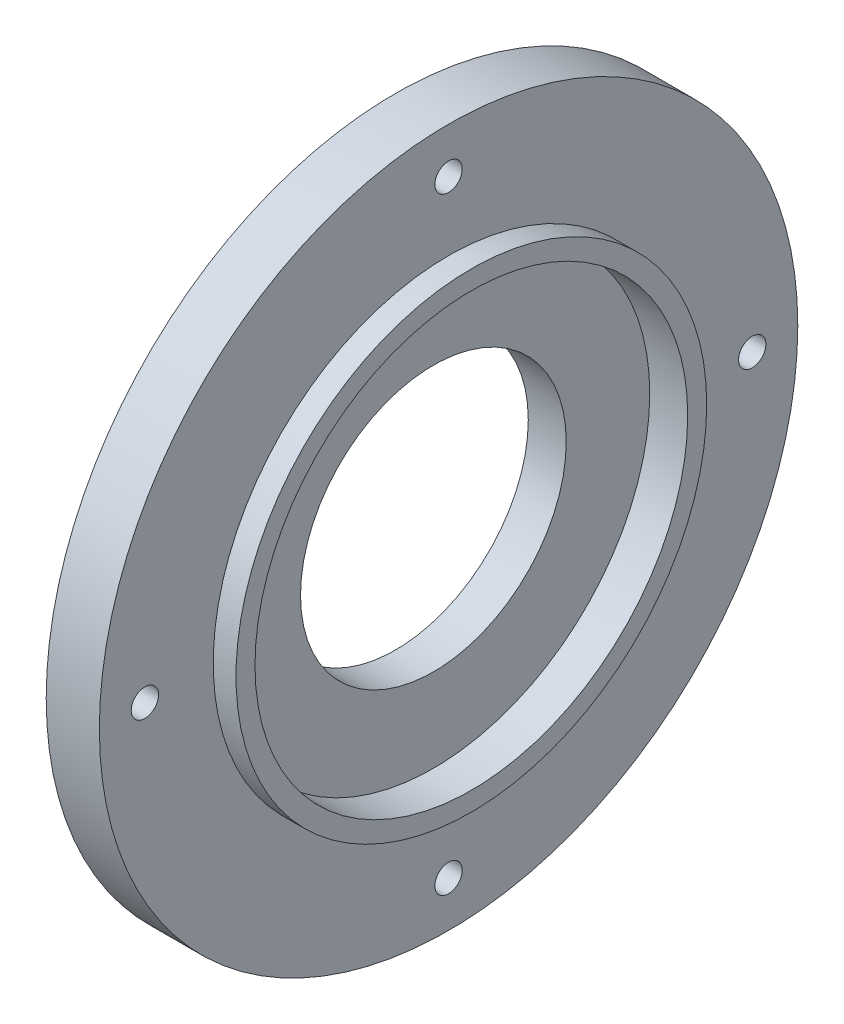
from build123d import *

# Parameters (mm, degrees)
SKETCH_1_R          = 46
SKETCH_1_R_2        = 17.5
EXTRUDE_1_DEPTH     = 5
SKETCH_2_R          = 31
SKETCH_2_R_2        = 28.5
EXTRUDE_2_DEPTH     = 5
SKETCH_4_R          = 46
SKETCH_4_R_2        = 31
EXTRUDE_3_DEPTH     = 2
SKETCH_5_R          = 1.8
CUT_EXTRUDE_1_DEPTH = 7


with BuildPart() as part:
    # 草图1 → 凸台-拉伸1 (new body)
    with BuildSketch(Plane(origin=(0, 0, 0), x_dir=(0, 0, -1), z_dir=(1, 0, 0))):
        Circle(SKETCH_1_R)
        Circle(SKETCH_1_R_2, mode=Mode.SUBTRACT)
    extrude(amount=EXTRUDE_1_DEPTH)

    # 草图2 → 凸台-拉伸2 (add)
    with BuildSketch(Plane(origin=(5, 0, 0), x_dir=(0, 0, -1), z_dir=(1, 0, 0))):
        Circle(SKETCH_2_R)
        Circle(SKETCH_2_R_2, mode=Mode.SUBTRACT)
    extrude(amount=EXTRUDE_2_DEPTH)

    # 草图4 → 凸台-拉伸3 (add)
    with BuildSketch(Plane(origin=(5, 0, 0), x_dir=(0, 0, -1), z_dir=(1, 0, 0))):
        Circle(SKETCH_4_R)
        Circle(SKETCH_4_R_2, mode=Mode.SUBTRACT)
    extrude(amount=EXTRUDE_3_DEPTH)

    # 草图5 → 切除-拉伸1 (cut)
    with BuildSketch(Plane.ZY):
        with Locations((0, 40)):
            Circle(SKETCH_5_R)
        with Locations((40, 0)):
            Circle(SKETCH_5_R)
        with Locations((0, -40)):
            Circle(SKETCH_5_R)
        with Locations((-40, 0)):
            Circle(SKETCH_5_R)
    extrude(amount=-CUT_EXTRUDE_1_DEPTH, mode=Mode.SUBTRACT)


solid = part.part
